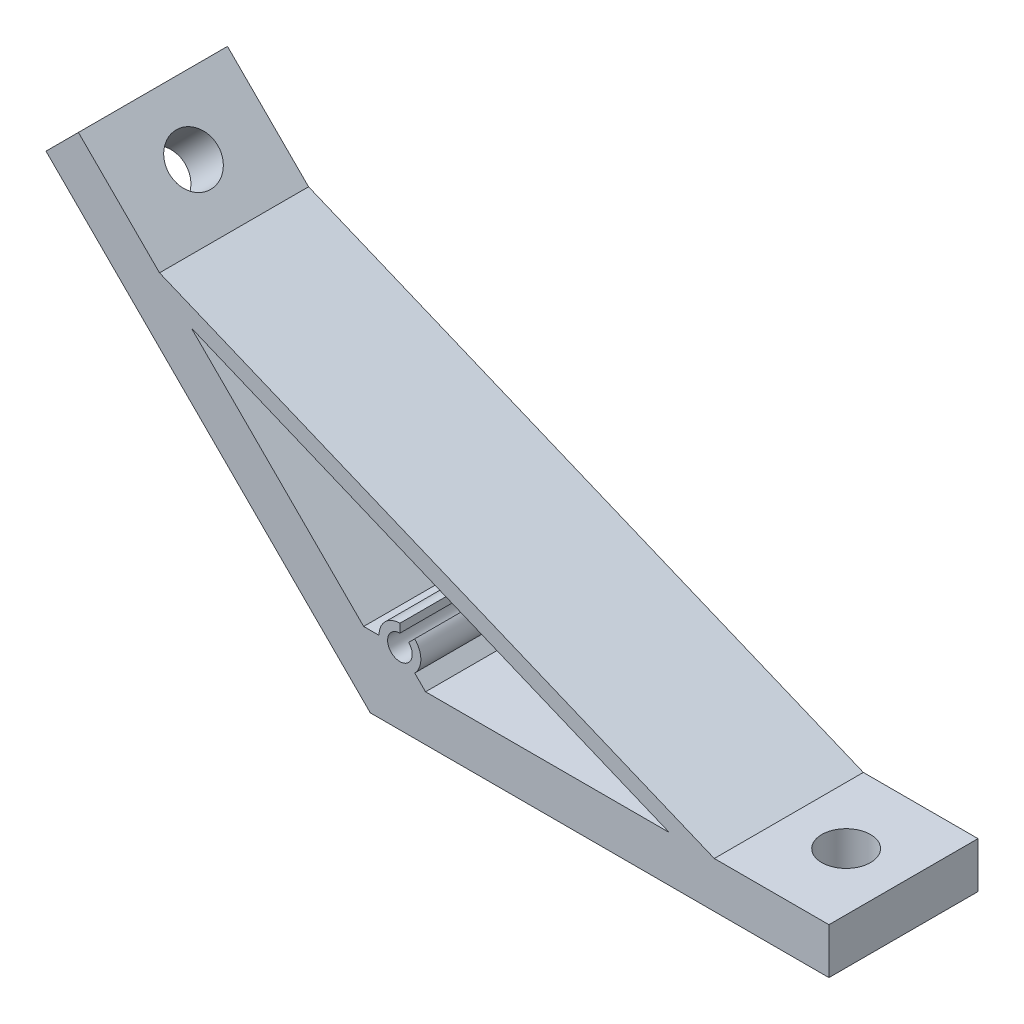
from build123d import *

# Parameters (mm, degrees)
EXTRUDE_1_DEPTH     = 13
SKETCH_3_R          = 4.25
CUT_EXTRUDE_1_DEPTH = 98.51611996


with BuildPart() as part:
    # 草图1 → 凸台-拉伸1 (new, symmetric)
    with BuildSketch(Plane.XY):
        Polygon((80, 0), (0, 0), (-56.568542495, 56.568542495), (-50.911688245, 62.225396744), (-36.769552622, 48.083261121), (60, 8), (80, 8), align=None)
        with BuildLine():
            Line((52.160622211, 8), (9.638600026, 8))
            Line((9.638600026, 8), (7.747166088, 9.891433938))
            ThreePointArc((7.747166088, 9.891433938), (8.816226337, 12.472373689), (7.747166088, 15.05331344))
            Line((7.747166088, 15.05331344), (6.686505916, 13.992653268))
            ThreePointArc((6.686505916, 13.992653268), (4.343456957, 10.486032694), (5.166226337, 14.622373689))
            Line((5.166226337, 14.622373689), (5.166226337, 16.122373689))
            ThreePointArc((5.166226337, 16.122373689), (2.585286586, 15.05331344), (1.516226337, 12.472373689))
            Line((1.516226337, 12.472373689), (-1.15866519, 12.472373689))
            Line((-1.15866519, 12.472373689), (-31.226275427, 42.539983926))
            Line((-31.226275427, 42.539983926), (52.160622211, 8))
        make_face(mode=Mode.SUBTRACT)
    extrude(amount=EXTRUDE_1_DEPTH, both=True)

    # 草图3 → 切除-拉伸1 (cut, through all)
    with BuildSketch(Plane(origin=(0, 8, 0), x_dir=(1, 0, 0), z_dir=(0, 1, 0))):
        with Locations(Location((70, 0, 0), (0, 0, 180))):
            Circle(SKETCH_3_R)
    cut_extrude_1 = extrude(amount=-CUT_EXTRUDE_1_DEPTH, mode=Mode.SUBTRACT)

    # 镜向1: 切除-拉伸1 across plane
    add(cut_extrude_1.mirror(Plane(origin=(0, 0, 0), x_dir=(0, 0, 1), z_dir=(-0.9238795325112867, 0.3826834323650898, 0))), mode=Mode.SUBTRACT)


solid = part.part
